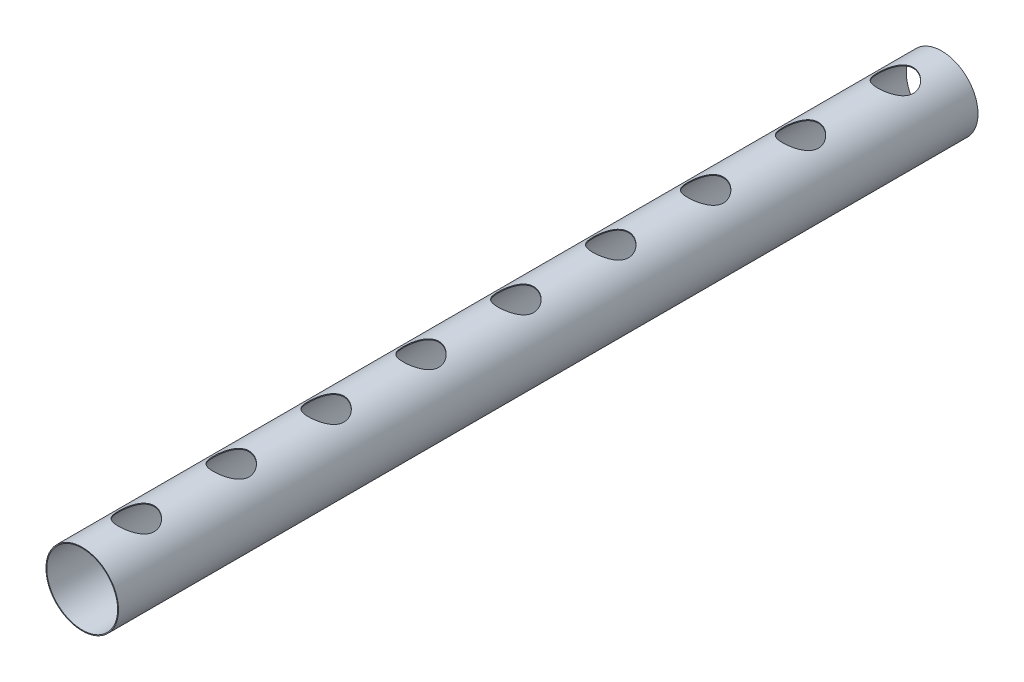
from build123d import *

# Parameters (mm, degrees)
SKETCH_1_R             = 32.5
SKETCH_1_R_2           = 31.75
EXTRUDE_1_DEPTH        = 770
CUT_EXTRUDE_1_REACH    = 773.371
SKETCH_2_R             = 16
PATTERN_LINEAR_1_COUNT = 9
PATTERN_LINEAR_1_PITCH = 85


with BuildPart() as part:
    # 스케치1 → 보스-돌출1 (new body)
    with BuildSketch(Plane.XY):
        Circle(SKETCH_1_R)
        Circle(SKETCH_1_R_2, mode=Mode.SUBTRACT)
    extrude(amount=EXTRUDE_1_DEPTH)

    # 스케치2 → 컷-돌출1 (cut, up to next)
    with BuildSketch(Plane(origin=(0, 0, 0), x_dir=(1, 0, 0), z_dir=(0, 1, 0)), mode=Mode.PRIVATE) as cut_extrude_1_sk1:
        with Locations(Location((0, -41.5, 0), (0, 0, 90))):
            Circle(SKETCH_2_R)
    cut_extrude_1_tool1 = extrude(cut_extrude_1_sk1.sketch, amount=CUT_EXTRUDE_1_REACH, mode=Mode.PRIVATE) & part.part
    cut_extrude_1 = cut_extrude_1_tool1.solids().sort_by_distance((0, 0, 41.5))[0]
    add(cut_extrude_1, mode=Mode.SUBTRACT)

    # 선형 패턴1: 컷-돌출1 ×9
    with Locations(*[(0, 0, i * PATTERN_LINEAR_1_PITCH) for i in range(1, PATTERN_LINEAR_1_COUNT)]):
        add(cut_extrude_1, mode=Mode.SUBTRACT)


solid = part.part
